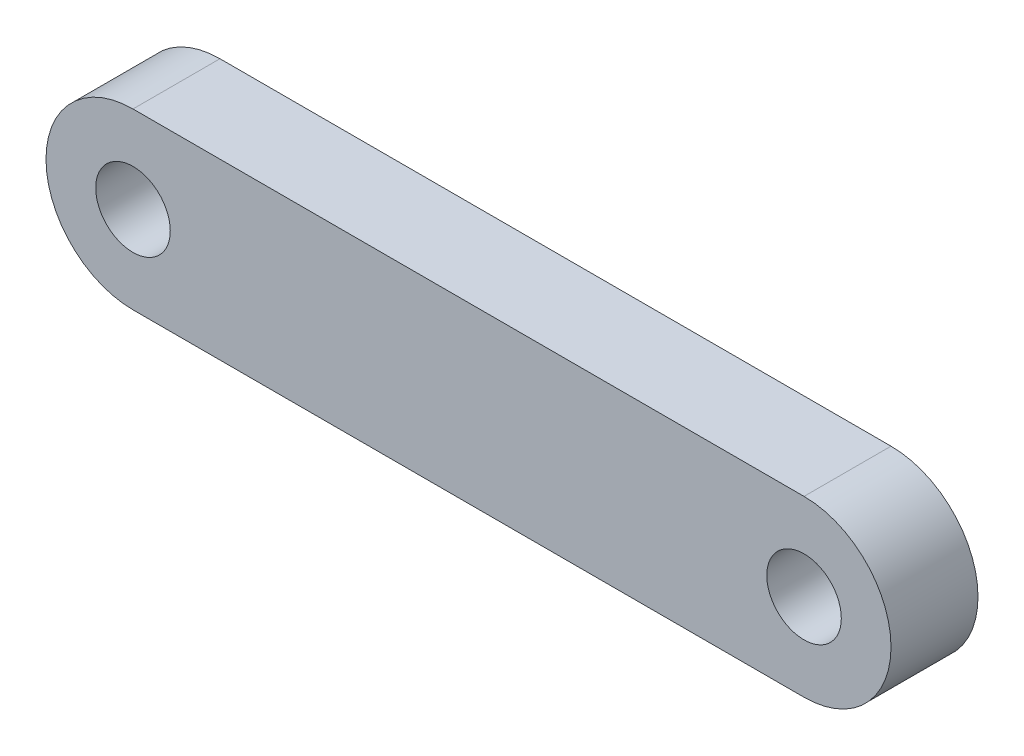
from build123d import *

# Parameters (mm, degrees)
SKETCH1_R           = 1.5
BOSS_EXTRUDE1_DEPTH = 3.5


with BuildPart() as part:
    # Sketch1 → Boss-Extrude1 (new body)
    with BuildSketch(Plane.XY):
        with BuildLine():
            Line((0, 0), (27, 0))
            ThreePointArc((27, 0), (30.5, -3.5), (27, -7))
            Line((27, -7), (0, -7))
            ThreePointArc((0, -7), (-3.5, -3.5), (0, 0))
        make_face()
        with Locations((0, -3.5)):
            Circle(SKETCH1_R, mode=Mode.SUBTRACT)
        with Locations((27, -3.5)):
            Circle(SKETCH1_R, mode=Mode.SUBTRACT)
    extrude(amount=BOSS_EXTRUDE1_DEPTH)


solid = part.part
